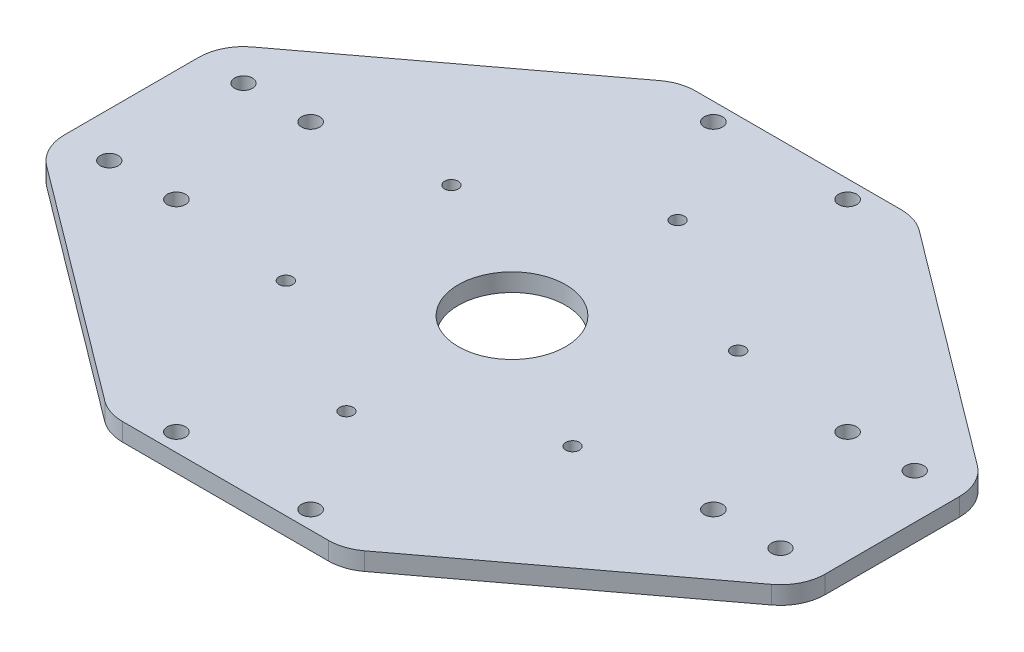
from build123d import *

# Parameters (mm, degrees)
SKETCH_1_W          = 170
SKETCH_1_H          = 130
SKETCH_1_R          = 1.525
SKETCH_1_R_2        = 12
EXTRUDE_1_DEPTH     = 4
SKETCH_2_R          = 2.025
SKETCH_2_R_2        = 2
SKETCH_2_W          = 20
SKETCH_2_H          = 20
CUT_EXTRUDE_1_DEPTH = 4
CUT_EXTRUDE_2_DEPTH = 10
SKETCH_4_W          = 52.666666666
SKETCH_4_H          = 5
CUT_EXTRUDE_3_DEPTH = 108.079409785
FILLET_1_R          = 10


with BuildPart() as part:
    # 草图1 → 凸台-拉伸1 (new body)
    with BuildSketch(Plane(origin=(0, 0, 0), x_dir=(1, 0, 0), z_dir=(0, 1, 0))):
        Rectangle(SKETCH_1_W, SKETCH_1_H)
        with Locations(Location((0, -37, 0), (0, 0, 270))):
            Circle(SKETCH_1_R, mode=Mode.SUBTRACT)
        with Locations(Location((-32.04293994, -18.5, 0), (0, 0, 270))):
            Circle(SKETCH_1_R, mode=Mode.SUBTRACT)
        with Locations(Location((-32.04293994, 18.5, 0), (0, 0, 270))):
            Circle(SKETCH_1_R, mode=Mode.SUBTRACT)
        with Locations(Location((0, 37, 0), (0, 0, 270))):
            Circle(SKETCH_1_R, mode=Mode.SUBTRACT)
        with Locations(Location((32.04293994, 18.5, 0), (0, 0, 270))):
            Circle(SKETCH_1_R, mode=Mode.SUBTRACT)
        with Locations(Location((32.04293994, -18.5, 0), (0, 0, 270))):
            Circle(SKETCH_1_R, mode=Mode.SUBTRACT)
        with Locations(Location((0, 0, 0), (0, 0, 270))):
            Circle(SKETCH_1_R_2, mode=Mode.SUBTRACT)
    extrude(amount=EXTRUDE_1_DEPTH)

    # 草图2 → 切除-拉伸1 (cut)
    with BuildSketch(Plane(origin=(0, 4, 0), x_dir=(1, 0, 0), z_dir=(0, 1, 0))):
        with Locations(Location((-15, 60, 0), (0, 0, 270))):
            Circle(SKETCH_2_R)
        with Locations(Location((-75, 15, 0), (0, 0, 270))):
            Circle(SKETCH_2_R_2)
        with Locations(Location((75, 15, 0), (0, 0, 90))):
            Circle(SKETCH_2_R_2)
        with Locations(Location((15, 60, 0), (0, 0, 90))):
            Circle(SKETCH_2_R)
        with Locations(Location((75, -15, 0), (0, 0, 270))):
            Circle(SKETCH_2_R_2)
        with Locations(Location((-75, -15, 0), (0, 0, 90))):
            Circle(SKETCH_2_R_2)
        with Locations(Location((60, 15, 0), (0, 0, 270))):
            Circle(SKETCH_2_R)
        with Locations(Location((60, -15, 0), (0, 0, 90))):
            Circle(SKETCH_2_R)
        with Locations(Location((15, -60, 0), (0, 0, 270))):
            Circle(SKETCH_2_R)
        with Locations(Location((-15, -60, 0), (0, 0, 90))):
            Circle(SKETCH_2_R)
        with Locations(Location((-60, -15, 0), (0, 0, 270))):
            Circle(SKETCH_2_R)
        with Locations(Location((-60, 15, 0), (0, 0, 90))):
            Circle(SKETCH_2_R)
        with Locations((-75, 55)):
            Rectangle(SKETCH_2_W, SKETCH_2_H)
        with Locations((75, 55)):
            Rectangle(SKETCH_2_W, SKETCH_2_H)
        with Locations((75, -55)):
            Rectangle(SKETCH_2_W, SKETCH_2_H)
        with Locations((-75, -55)):
            Rectangle(SKETCH_2_W, SKETCH_2_H)
    extrude(amount=-CUT_EXTRUDE_1_DEPTH, mode=Mode.SUBTRACT)

    # 草图3 → 切除-拉伸2 (cut)
    with BuildSketch(Plane(origin=(0, 4, 0), x_dir=(1, 0, 0), z_dir=(0, 1, 0))):
        Polygon((-85, 20), (-85, 65), (-25, 65), align=None)
        Polygon((-85, -65), (-25, -65), (-85, -20), align=None)
        Polygon((85, -20), (85, -65), (25, -65), align=None)
        Polygon((85, 65), (25, 65), (85, 20), align=None)
    extrude(amount=-CUT_EXTRUDE_2_DEPTH, mode=Mode.SUBTRACT)

    # 草图4 → 切除-拉伸3 (cut, through all)
    with BuildSketch(Plane(origin=(0, 4, 0), x_dir=(1, 0, 0), z_dir=(0, 1, 0))):
        with Locations((0, 66.5)):
            Rectangle(SKETCH_4_W, SKETCH_4_H)
        with Locations((0, -66.5)):
            Rectangle(SKETCH_4_W, SKETCH_4_H)
    extrude(amount=-CUT_EXTRUDE_3_DEPTH, mode=Mode.SUBTRACT)

    # 圆角1
    fillet_1_edges = [part.edges().sort_by_distance(p)[0] for p in [
        (85, 2, -20),
        (85, 2, 20),
        (-85, 2, 20),
        (-85, 2, -20),
        (-26.333333333, 2, -64),
        (26.333333333, 2, -64),
        (-26.333333333, 2, 64),
        (26.333333333, 2, 64),
    ]]
    fillet(fillet_1_edges, radius=FILLET_1_R)


solid = part.part
